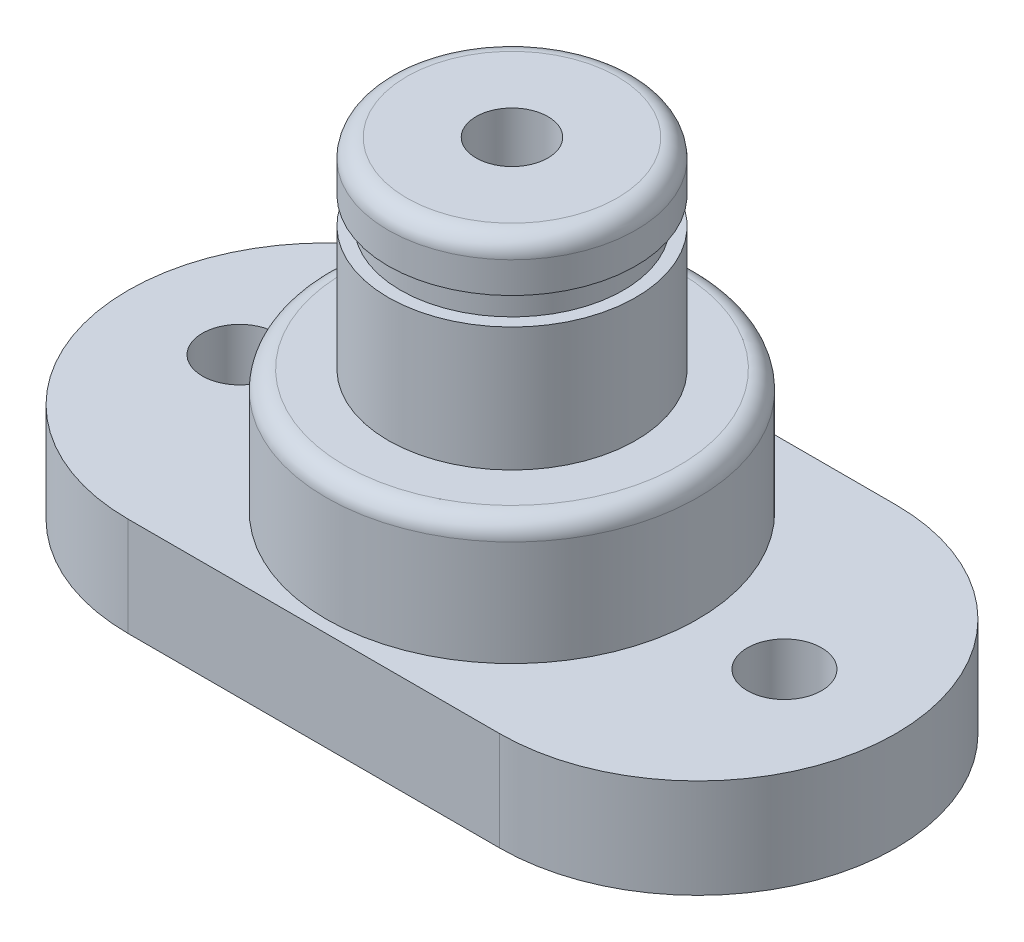
from build123d import *

# Parameters (mm, degrees)
SKETCH_8_R          = 1.5
SKETCH_8_W          = 15
SKETCH_8_H          = 16
EXTRUDE_4_DEPTH     = 4
SKETCH_9_R          = 7.5
EXTRUDE_5_DEPTH     = 5
SKETCH_10_R         = 5
EXTRUDE_6_DEPTH     = 5
SKETCH_12_R         = 4.5
EXTRUDE_7_DEPTH     = 1.1
SKETCH_14_R         = 1.45
CUT_EXTRUDE_1_DEPTH = 24.070760716
SKETCH_15_R         = 5
EXTRUDE_8_DEPTH     = 2
FILLET_2_R          = 0.75
SKETCH_16_R         = 1.45
CUT_EXTRUDE_2_DEPTH = 25.426624818


with BuildPart() as part:
    # 草图8 → 凸台-拉伸4 (new body)
    # profile 1 of 3: a face of its own
    with BuildSketch(Plane(origin=(0, 0, 0), x_dir=(1, 0, 0), z_dir=(0, 1, 0))):
        with BuildLine():
            Line((-7.5, 8), (-7.5, -8))
            ThreePointArc((-7.5, -8), (-15.5, 0), (-7.5, 8))
        make_face()
        with Locations(Location((-11, 0, 0), (0, 0, 270))):
            Circle(SKETCH_8_R, mode=Mode.SUBTRACT)
    # profile 2 of 3: a face of its own
    with BuildSketch(Plane(origin=(0, 0, 0), x_dir=(1, 0, 0), z_dir=(0, 1, 0))):
        Rectangle(SKETCH_8_W, SKETCH_8_H)
    # profile 3 of 3: a face of its own
    with BuildSketch(Plane(origin=(0, 0, 0), x_dir=(1, 0, 0), z_dir=(0, 1, 0))):
        with BuildLine():
            Line((7.5, 8), (7.5, -8))
            ThreePointArc((7.5, -8), (15.5, 0), (7.5, 8))
        make_face()
        with Locations(Location((11, 0, 0), (0, 0, 270))):
            Circle(SKETCH_8_R, mode=Mode.SUBTRACT)
    extrude(amount=EXTRUDE_4_DEPTH)

    # 草图9 → 凸台-拉伸5 (add)
    with BuildSketch(Plane(origin=(0, 4, 0), x_dir=(1, 0, 0), z_dir=(0, 1, 0))):
        with Locations(Location((0, 0, 0), (0, 0, 270))):
            Circle(SKETCH_9_R)
    extrude(amount=EXTRUDE_5_DEPTH)

    # 草图10 → 凸台-拉伸6 (add)
    with BuildSketch(Plane(origin=(0, 9, 0), x_dir=(1, 0, 0), z_dir=(0, 1, 0))):
        with Locations(Location((0, 0, 0), (0, 0, 270))):
            Circle(SKETCH_10_R)
    extrude(amount=EXTRUDE_6_DEPTH)

    # 草图12 → 凸台-拉伸7 (add)
    with BuildSketch(Plane(origin=(0, 14, 0), x_dir=(1, 0, 0), z_dir=(0, 1, 0))):
        with Locations(Location((0, 0, 0), (0, 0, 270))):
            Circle(SKETCH_12_R)
    extrude(amount=EXTRUDE_7_DEPTH)

    # 草图14 → 切除-拉伸1 (cut, through all)
    with BuildSketch(Plane.XZ):
        with Locations(Location((0, 0, 0), (0, 0, 270))):
            Circle(SKETCH_14_R)
    extrude(amount=-CUT_EXTRUDE_1_DEPTH, mode=Mode.SUBTRACT)

    # 草图15 → 凸台-拉伸8 (add)
    with BuildSketch(Plane(origin=(0, 15.1, 0), x_dir=(1, 0, 0), z_dir=(0, 1, 0))):
        with Locations(Location((0, 0, 0), (0, 0, 270))):
            Circle(SKETCH_15_R)
    extrude(amount=EXTRUDE_8_DEPTH)

    # 圆角2
    fillet_2_edges = [part.edges().sort_by_distance(p)[0] for p in [
        (0, 9, -7.5),
        (0, 17.1, -5),
    ]]
    fillet(fillet_2_edges, radius=FILLET_2_R)

    # 草图16 → 切除-拉伸2 (cut, through all)
    with BuildSketch(Plane(origin=(0, 0, 0), x_dir=(-1, 0, 0), z_dir=(0, -1, 0))):
        with Locations(Location((0, 0, 0), (0, 0, 90))):
            Circle(SKETCH_16_R)
    extrude(amount=-CUT_EXTRUDE_2_DEPTH, mode=Mode.SUBTRACT)


solid = part.part
